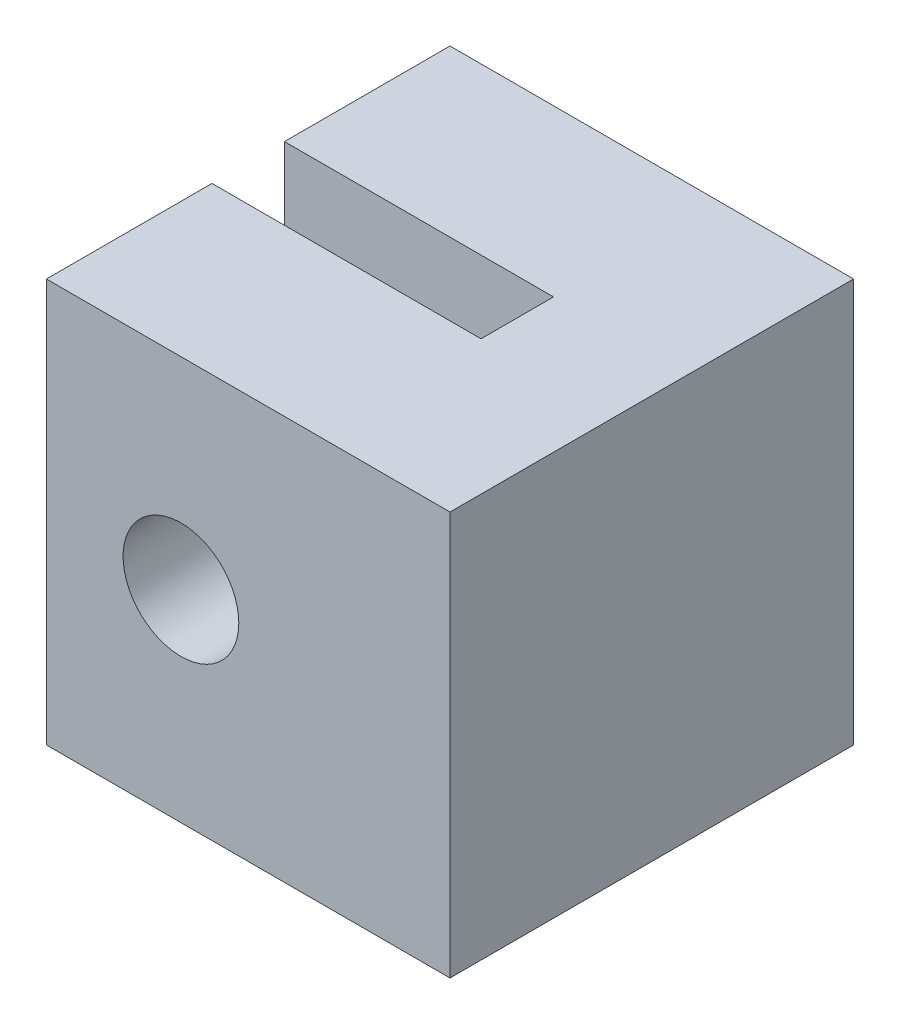
from build123d import *

# Parameters (mm, degrees)
SKETCH1_W           = 15
SKETCH1_H           = 15
BOSS_EXTRUDE1_DEPTH = 15
SKETCH2_W           = 2.69425289
SKETCH2_H           = 15
CUT_EXTRUDE1_DEPTH  = 10
SKETCH3_R           = 2.15
CUT_EXTRUDE2_DEPTH  = 37


with BuildPart() as part:
    # Sketch1 → Boss-Extrude1 (new body)
    with BuildSketch(Plane.XY):
        Rectangle(SKETCH1_W, SKETCH1_H)
    extrude(amount=BOSS_EXTRUDE1_DEPTH)

    # Sketch2 → Cut-Extrude1 (cut)
    with BuildSketch(Plane.ZY.offset(7.5)):
        with Locations((7.5, 0)):
            Rectangle(SKETCH2_W, SKETCH2_H)
    extrude(amount=-CUT_EXTRUDE1_DEPTH, mode=Mode.SUBTRACT)

    # Sketch3 → Cut-Extrude2 (cut)
    with BuildSketch(Plane.XY.offset(15)):
        with Locations((-2.5, 0)):
            Circle(SKETCH3_R)
    extrude(amount=-CUT_EXTRUDE2_DEPTH, mode=Mode.SUBTRACT)


solid = part.part
